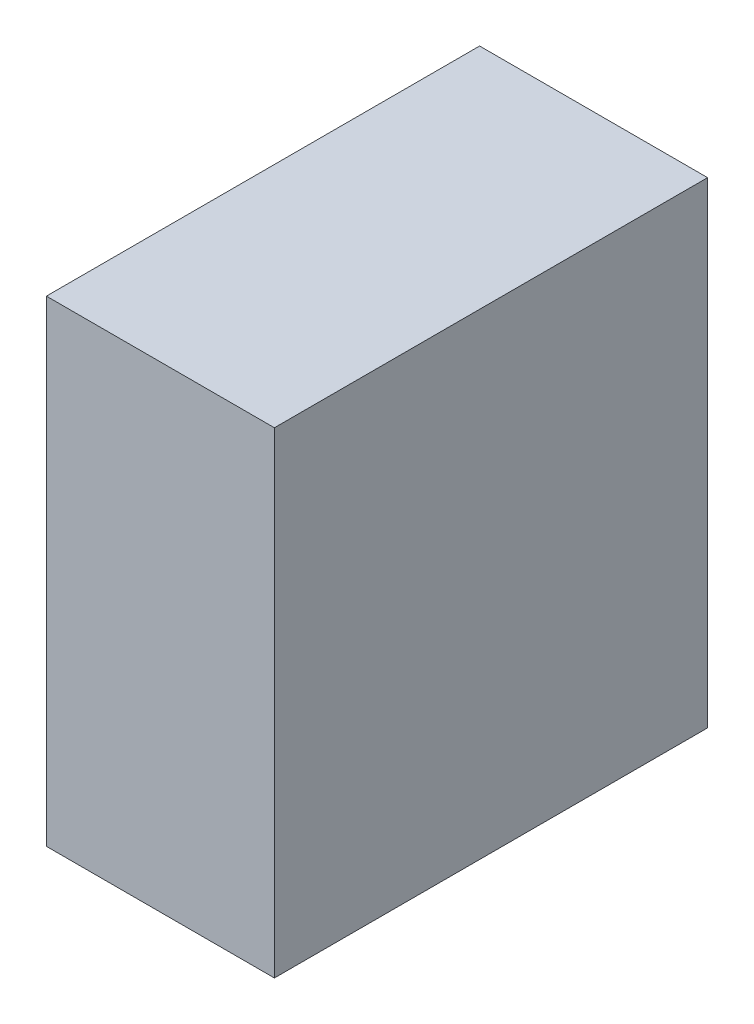
from build123d import *

# Parameters (mm, degrees)
PACK_BLANK_YIGINI_525_ADET_1_START = -30
SKETCH1_W                          = 400
SKETCH1_H                          = 836
PACK_BLANK_YIGINI_525_ADET_1_DEPTH = 760


with BuildPart() as part:
    # Sketch1 → PACK_blank_yigini_525_adet_1 (new body)
    with BuildSketch(Plane.XY.offset(PACK_BLANK_YIGINI_525_ADET_1_START)):
        with Locations((350, 1462)):
            Rectangle(SKETCH1_W, SKETCH1_H)
    extrude(amount=-PACK_BLANK_YIGINI_525_ADET_1_DEPTH)


solid = part.part
